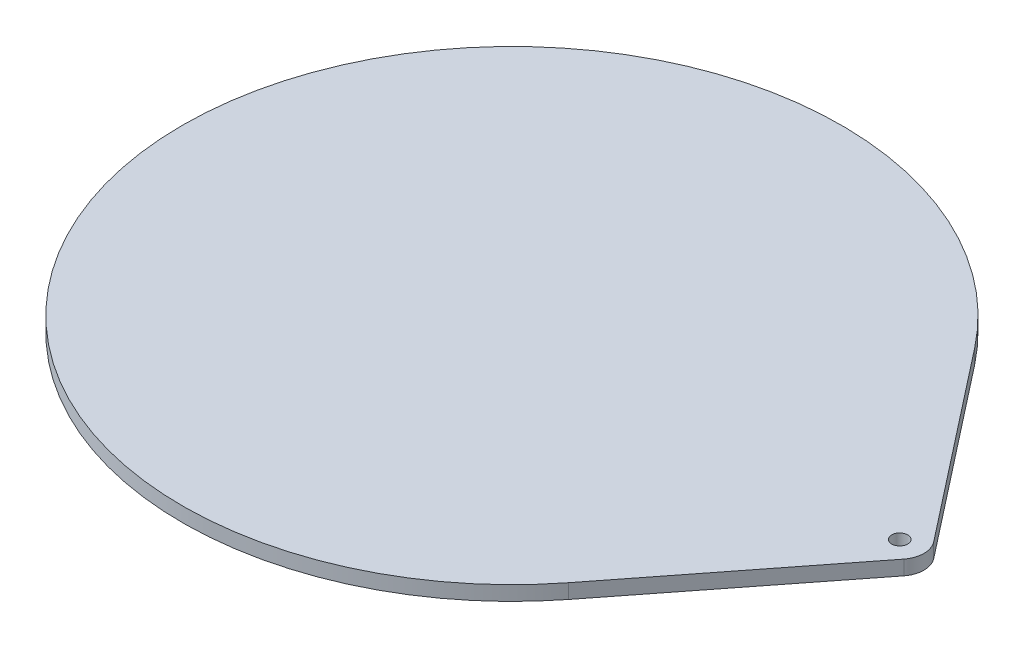
from build123d import *

# Parameters (mm, degrees)
SKETCH1_R           = 1.65
BOSS_EXTRUDE1_DEPTH = 3


with BuildPart() as part:
    # Sketch1 → Boss-Extrude1 (new body)
    with BuildSketch(Plane(origin=(0, 0, 0), x_dir=(1, 0, 0), z_dir=(0, 1, 0))):
        with BuildLine():
            Line((53.55, -41.909396321), (83.9375, -3.081573259))
            ThreePointArc((83.9375, -3.081573259), (85, 0), (83.9375, 3.081573259))
            Line((83.9375, 3.081573259), (53.55, 41.909396321))
            ThreePointArc((53.55, 41.909396321), (-68, 0), (53.55, -41.909396321))
        make_face()
        with Locations(Location((80, 0, 0), (0, 0, 270))):
            Circle(SKETCH1_R, mode=Mode.SUBTRACT)
    extrude(amount=BOSS_EXTRUDE1_DEPTH)


solid = part.part
